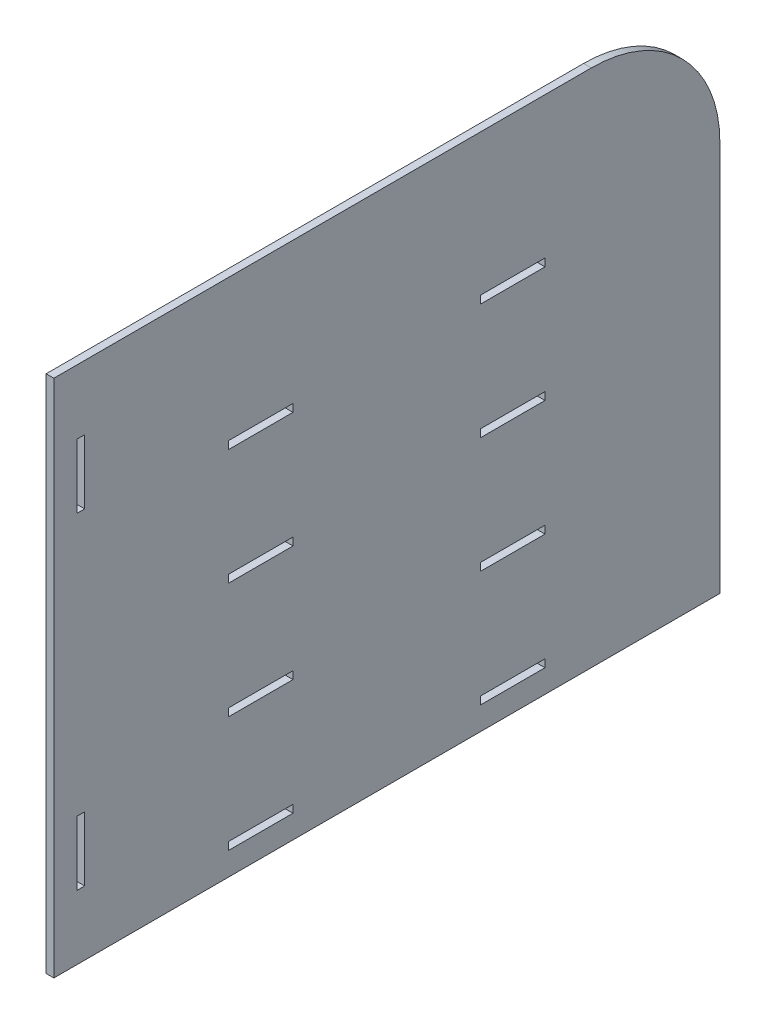
from build123d import *

# Parameters (mm, degrees)
SKETCH1_W           = 6
SKETCH1_H           = 50
SKETCH1_W_2         = 50
SKETCH1_H_2         = 6
BOSS_EXTRUDE1_DEPTH = 6


with BuildPart() as part:
    # Sketch1 → Boss-Extrude1 (new body)
    with BuildSketch(Plane(origin=(0, 0, 0), x_dir=(0, 0, -1), z_dir=(1, 0, 0))):
        with BuildLine():
            Line((-414.831767264, 67.151199882), (3.168232736, 67.151199882))
            ThreePointArc((3.168232736, 67.151199882), (73.878910855, 37.861878001), (103.168232736, -32.848800118))
            Line((103.168232736, -32.848800118), (103.168232736, -336.848800118))
            Line((103.168232736, -336.848800118), (-414.831767264, -336.848800118))
            Line((-414.831767264, -336.848800118), (-414.831767264, 67.151199882))
        make_face()
        with Locations((-393.831767264, -7.848800118)):
            Rectangle(SKETCH1_W, SKETCH1_H, mode=Mode.SUBTRACT)
        with Locations((-393.831767264, -261.848800118)):
            Rectangle(SKETCH1_W, SKETCH1_H, mode=Mode.SUBTRACT)
        with Locations((-253.831767264, -315.848800118)):
            Rectangle(SKETCH1_W_2, SKETCH1_H_2, mode=Mode.SUBTRACT)
        with Locations((-57.831767264, -315.848800118)):
            Rectangle(SKETCH1_W_2, SKETCH1_H_2, mode=Mode.SUBTRACT)
        with Locations((-253.831767264, -225.848800118)):
            Rectangle(SKETCH1_W_2, SKETCH1_H_2, mode=Mode.SUBTRACT)
        with Locations((-57.831767264, -225.848800118)):
            Rectangle(SKETCH1_W_2, SKETCH1_H_2, mode=Mode.SUBTRACT)
        with Locations((-253.831767264, -135.848800118)):
            Rectangle(SKETCH1_W_2, SKETCH1_H_2, mode=Mode.SUBTRACT)
        with Locations((-57.831767264, -135.848800118)):
            Rectangle(SKETCH1_W_2, SKETCH1_H_2, mode=Mode.SUBTRACT)
        with Locations((-253.831767264, -45.848800118)):
            Rectangle(SKETCH1_W_2, SKETCH1_H_2, mode=Mode.SUBTRACT)
        with Locations((-57.831767264, -45.848800118)):
            Rectangle(SKETCH1_W_2, SKETCH1_H_2, mode=Mode.SUBTRACT)
    extrude(amount=BOSS_EXTRUDE1_DEPTH)


solid = part.part
